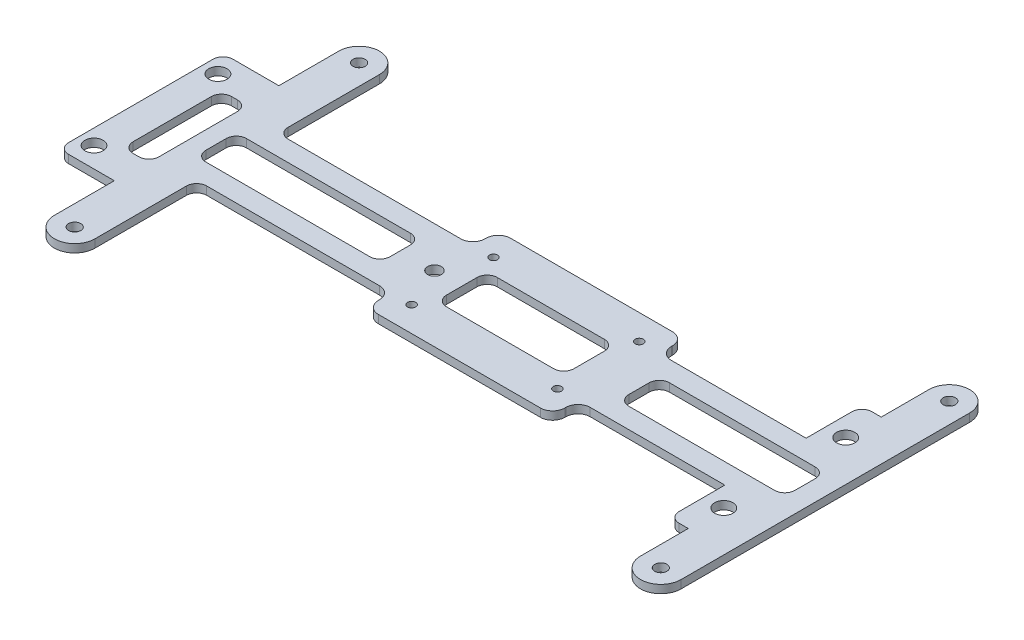
from build123d import *

# Parameters (mm, degrees)
CROQUIS1_R              = 3
CROQUIS1_R_2            = 3.4
CROQUIS1_R_3            = 2
CROQUIS1_R_4            = 4.5
CROQUIS1_W              = 12.8
CROQUIS1_H              = 48.5
CROQUIS1_W_2            = 62.75
CROQUIS1_H_2            = 25
CROQUIS1_W_3            = 90.7
CROQUIS1_H_3            = 20
CROQUIS1_W_4            = 81.75
SALIENTE_EXTRUIR1_DEPTH = 4
REDONDEO1_R             = 5


with BuildPart() as part:
    # Croquis1 → Saliente-Extruir1 (new body)
    with BuildSketch(Plane(origin=(0, 0, 0), x_dir=(1, 0, 0), z_dir=(0, 1, 0))):
        with BuildLine():
            Line((0, -35.5), (0, 35.5))
            ThreePointArc((0, 35.5), (1.464466094, 39.035533906), (5, 40.5))
            Line((5, 40.5), (27.5, 40.5))
            Line((27.5, 40.5), (27.5, 70))
            ThreePointArc((27.5, 70), (37.5, 80), (47.5, 70))
            Line((47.5, 70), (47.5, 25))
            ThreePointArc((47.5, 25), (48.964466094, 21.464466094), (52.5, 20))
            Line((52.5, 20), (137.5, 20))
            ThreePointArc((137.5, 20), (141.742640687, 21.757359313), (143.5, 26))
            Line((143.5, 26), (143.5, 26.5))
            ThreePointArc((143.5, 26.5), (145.257359313, 30.742640687), (149.5, 32.5))
            Line((149.5, 32.5), (229.25, 32.5))
            ThreePointArc((229.25, 32.5), (233.492640687, 30.742640687), (235.25, 26.5))
            Line((235.25, 26.5), (235.25, 26))
            ThreePointArc((235.25, 26), (237.007359313, 21.757359313), (241.25, 20))
            Line((241.25, 20), (307.5, 20))
            Line((307.5, 20), (307.5, 42.5))
            ThreePointArc((307.5, 42.5), (308.964466094, 46.035533906), (312.5, 47.5))
            Line((312.5, 47.5), (317, 47.5))
            Line((317, 47.5), (317, 71))
            ThreePointArc((317, 71), (327, 81), (337, 71))
            Line((337, 71), (337, -71))
            ThreePointArc((337, -71), (327, -81), (317, -71))
            Line((317, -71), (317, -47.5))
            Line((317, -47.5), (312.5, -47.5))
            ThreePointArc((312.5, -47.5), (308.964466094, -46.035533906), (307.5, -42.5))
            Line((307.5, -42.5), (307.5, -20))
            Line((307.5, -20), (241.25, -20))
            ThreePointArc((241.25, -20), (237.007359313, -21.757359313), (235.25, -26))
            Line((235.25, -26), (235.25, -26.5))
            ThreePointArc((235.25, -26.5), (233.492640687, -30.742640687), (229.25, -32.5))
            Line((229.25, -32.5), (149.5, -32.5))
            ThreePointArc((149.5, -32.5), (145.257359313, -30.742640687), (143.5, -26.5))
            Line((143.5, -26.5), (143.5, -26))
            ThreePointArc((143.5, -26), (141.742640687, -21.757359313), (137.5, -20))
            Line((137.5, -20), (52.5, -20))
            ThreePointArc((52.5, -20), (48.964466094, -21.464466094), (47.5, -25))
            Line((47.5, -25), (47.5, -70))
            ThreePointArc((47.5, -70), (37.5, -80), (27.5, -70))
            Line((27.5, -70), (27.5, -40.5))
            Line((27.5, -40.5), (5, -40.5))
            ThreePointArc((5, -40.5), (1.464466094, -39.035533906), (0, -35.5))
        make_face()
        with Locations(Location((37.5, 70, 0), (0, 0, 270))):
            Circle(CROQUIS1_R, mode=Mode.SUBTRACT)
        with Locations(Location((144.6, 0, 0), (0, 0, 270))):
            Circle(CROQUIS1_R_2, mode=Mode.SUBTRACT)
        with Locations(Location((153.5, 20.15, 0), (0, 0, 270))):
            Circle(CROQUIS1_R_3, mode=Mode.SUBTRACT)
        with Locations(Location((225.25, 20.15, 0), (0, 0, 270))):
            Circle(CROQUIS1_R_3, mode=Mode.SUBTRACT)
        with Locations(Location((317, 30, 0), (0, 0, 270))):
            Circle(CROQUIS1_R_4, mode=Mode.SUBTRACT)
        with Locations(Location((327, 71, 0), (0, 0, 270))):
            Circle(CROQUIS1_R, mode=Mode.SUBTRACT)
        with Locations(Location((7.5, 30.5, 0), (0, 0, 270))):
            Circle(CROQUIS1_R_4, mode=Mode.SUBTRACT)
        with Locations(Location((327, -71, 0), (0, 0, 90))):
            Circle(CROQUIS1_R, mode=Mode.SUBTRACT)
        with Locations(Location((317, -30, 0), (0, 0, 90))):
            Circle(CROQUIS1_R_4, mode=Mode.SUBTRACT)
        with Locations(Location((225.25, -20.15, 0), (0, 0, 90))):
            Circle(CROQUIS1_R_3, mode=Mode.SUBTRACT)
        with Locations(Location((153.5, -20.15, 0), (0, 0, 90))):
            Circle(CROQUIS1_R_3, mode=Mode.SUBTRACT)
        with Locations(Location((37.5, -70, 0), (0, 0, 90))):
            Circle(CROQUIS1_R, mode=Mode.SUBTRACT)
        with Locations(Location((7.5, -30.5, 0), (0, 0, 90))):
            Circle(CROQUIS1_R_4, mode=Mode.SUBTRACT)
        with Locations((21.9, 0)):
            Rectangle(CROQUIS1_W, CROQUIS1_H, mode=Mode.SUBTRACT)
        with Locations((189.375, 0)):
            Rectangle(CROQUIS1_W_2, CROQUIS1_H_2, mode=Mode.SUBTRACT)
        with Locations((82.4, 0)):
            Rectangle(CROQUIS1_W_3, CROQUIS1_H_3, mode=Mode.SUBTRACT)
        with Locations((286.125, 0)):
            Rectangle(CROQUIS1_W_4, CROQUIS1_H_3, mode=Mode.SUBTRACT)
    extrude(amount=SALIENTE_EXTRUIR1_DEPTH)

    # Redondeo1
    redondeo1_edges = [part.edges().sort_by_distance(p)[0] for p in [
        (127.75, 2, 10),
        (127.75, 2, -10),
        (37.05, 2, -10),
        (37.05, 2, 10),
        (28.3, 2, -24.25),
        (15.5, 2, -24.25),
        (15.5, 2, 24.25),
        (28.3, 2, 24.25),
        (327, 2, 10),
        (327, 2, -10),
        (245.25, 2, -10),
        (245.25, 2, 10),
        (220.75, 2, -12.5),
        (158, 2, -12.5),
        (158, 2, 12.5),
        (220.75, 2, 12.5),
    ]]
    fillet(redondeo1_edges, radius=REDONDEO1_R)


solid = part.part
